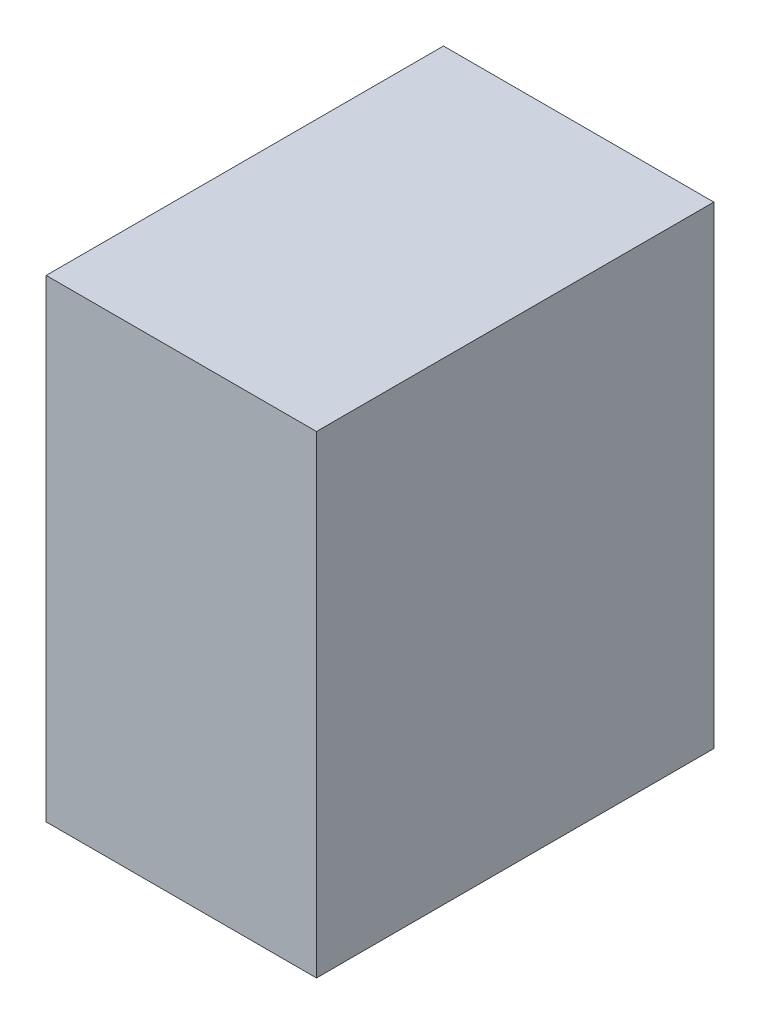
from build123d import *

# Parameters (mm, degrees)
SKETCH1_W           = 0.139625312
SKETCH1_H           = 0.166324086
BOSS_EXTRUDE1_DEPTH = 0.095


with BuildPart() as part:
    # Sketch1 → Boss-Extrude1 (new body)
    with BuildSketch(Plane(origin=(-13.793471613, 0, 0), x_dir=(0, 0, -1), z_dir=(1, 0, 0))):
        with Locations((-27.303564258, -29.113589981)):
            Rectangle(SKETCH1_W, SKETCH1_H)
    extrude(amount=BOSS_EXTRUDE1_DEPTH)


solid = part.part
